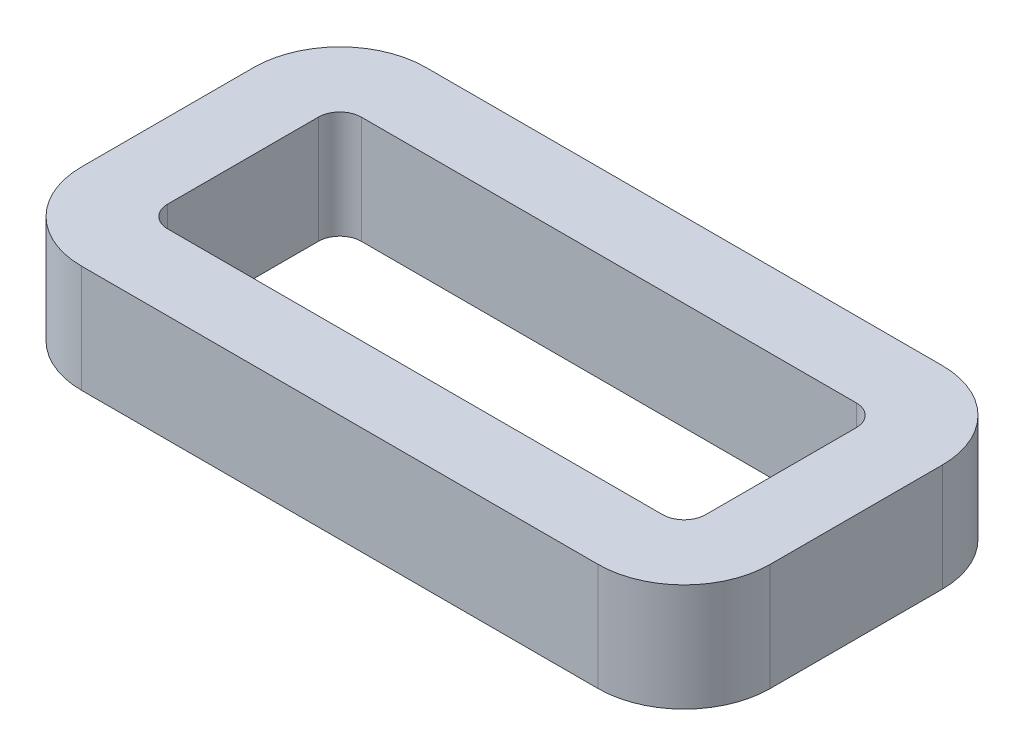
from build123d import *

# Parameters (mm, degrees)
SALIENTE_EXTRUIR2_DEPTH      = 1.25
SALIENTE_EXTRUIR2_DEPTH_BACK = 1.25


with BuildPart() as part:
    # Croquis1 → Saliente-Extruir2 (new, two sides: drawn at the far end of the back side and taken through both)
    with BuildSketch(Plane(origin=(0, 0, 0), x_dir=(1, 0, 0), z_dir=(0, 1, 0)).offset(-SALIENTE_EXTRUIR2_DEPTH_BACK)):
        with BuildLine():
            Line((2, 0), (14, 0))
            ThreePointArc((14, 0), (15.414213562, 0.585786438), (16, 2))
            Line((16, 2), (16, 6))
            ThreePointArc((16, 6), (15.414213562, 7.414213562), (14, 8))
            Line((14, 8), (2, 8))
            ThreePointArc((2, 8), (0.585786438, 7.414213562), (0, 6))
            Line((0, 6), (0, 2))
            ThreePointArc((0, 2), (0.585786438, 0.585786438), (2, 0))
        make_face()
        with BuildLine():
            Line((1.75, 5.75), (1.75, 2.25))
            ThreePointArc((1.75, 2.25), (1.896446609, 1.896446609), (2.25, 1.75))
            Line((2.25, 1.75), (13.75, 1.75))
            ThreePointArc((13.75, 1.75), (14.103553391, 1.896446609), (14.25, 2.25))
            Line((14.25, 2.25), (14.25, 5.75))
            ThreePointArc((14.25, 5.75), (14.103553391, 6.103553391), (13.75, 6.25))
            Line((13.75, 6.25), (2.25, 6.25))
            ThreePointArc((2.25, 6.25), (1.896446609, 6.103553391), (1.75, 5.75))
        make_face(mode=Mode.SUBTRACT)
    extrude(amount=SALIENTE_EXTRUIR2_DEPTH + SALIENTE_EXTRUIR2_DEPTH_BACK)


solid = part.part
